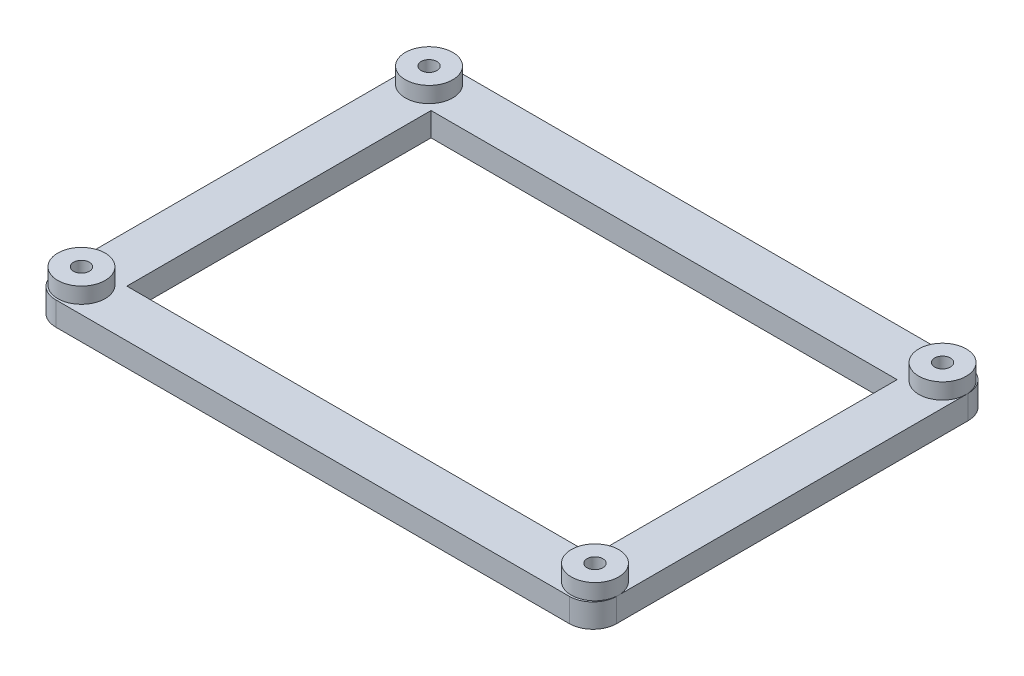
from build123d import *

# Parameters (mm, degrees)
SKETCH1_W           = 71
SKETCH1_H           = 50.5
SKETCH1_R           = 1
SKETCH1_W_2         = 59
SKETCH1_H_2         = 38.5
BOSS_EXTRUDE1_DEPTH = 3
SKETCH2_R           = 3
SKETCH2_R_2         = 1
BOSS_EXTRUDE2_DEPTH = 2
FILLET1_R           = 3


with BuildPart() as part:
    # Sketch1 → Boss-Extrude1 (new body)
    with BuildSketch(Plane(origin=(0, 0, 0), x_dir=(1, 0, 0), z_dir=(0, 1, 0))):
        Rectangle(SKETCH1_W, SKETCH1_H)
        with Locations(Location((-32.5, 22, 0), (0, 0, 270))):
            Circle(SKETCH1_R, mode=Mode.SUBTRACT)
        with Locations(Location((-32.5, -22, 0), (0, 0, 270))):
            Circle(SKETCH1_R, mode=Mode.SUBTRACT)
        with Locations(Location((32.5, -22, 0), (0, 0, 270))):
            Circle(SKETCH1_R, mode=Mode.SUBTRACT)
        with Locations(Location((32.5, 22, 0), (0, 0, 270))):
            Circle(SKETCH1_R, mode=Mode.SUBTRACT)
        Rectangle(SKETCH1_W_2, SKETCH1_H_2, mode=Mode.SUBTRACT)
    extrude(amount=BOSS_EXTRUDE1_DEPTH)

    # Sketch2 → Boss-Extrude2 (add)
    # profile 1 of 4: a face of its own
    with BuildSketch(Plane(origin=(0, 3, 0), x_dir=(1, 0, 0), z_dir=(0, 1, 0))):
        with Locations((32.5, 22)):
            Circle(SKETCH2_R)
        with Locations(Location((32.5, 22, 0), (0, 0, 270))):
            Circle(SKETCH2_R_2, mode=Mode.SUBTRACT)
    # profile 2 of 4: a face of its own
    with BuildSketch(Plane(origin=(0, 3, 0), x_dir=(1, 0, 0), z_dir=(0, 1, 0))):
        with Locations((32.5, -22)):
            Circle(SKETCH2_R)
        with Locations(Location((32.5, -22, 0), (0, 0, 270))):
            Circle(SKETCH2_R_2, mode=Mode.SUBTRACT)
    # profile 3 of 4: a face of its own
    with BuildSketch(Plane(origin=(0, 3, 0), x_dir=(1, 0, 0), z_dir=(0, 1, 0))):
        with Locations(Location((-32.5, -22, 0), (0, 0, 180))):
            Circle(SKETCH2_R)
        with Locations(Location((-32.5, -22, 0), (0, 0, 270))):
            Circle(SKETCH2_R_2, mode=Mode.SUBTRACT)
    # profile 4 of 4: a face of its own
    with BuildSketch(Plane(origin=(0, 3, 0), x_dir=(1, 0, 0), z_dir=(0, 1, 0))):
        with Locations(Location((-32.5, 22, 0), (0, 0, 180))):
            Circle(SKETCH2_R)
        with Locations(Location((-32.5, 22, 0), (0, 0, 270))):
            Circle(SKETCH2_R_2, mode=Mode.SUBTRACT)
    extrude(amount=BOSS_EXTRUDE2_DEPTH)

    # Fillet1
    fillet1_edges = [part.edges().sort_by_distance(p)[0] for p in [
        (35.5, 1.5, 25.25),
        (-35.5, 1.5, 25.25),
        (-35.5, 1.5, -25.25),
        (35.5, 1.5, -25.25),
    ]]
    fillet(fillet1_edges, radius=FILLET1_R)


solid = part.part
